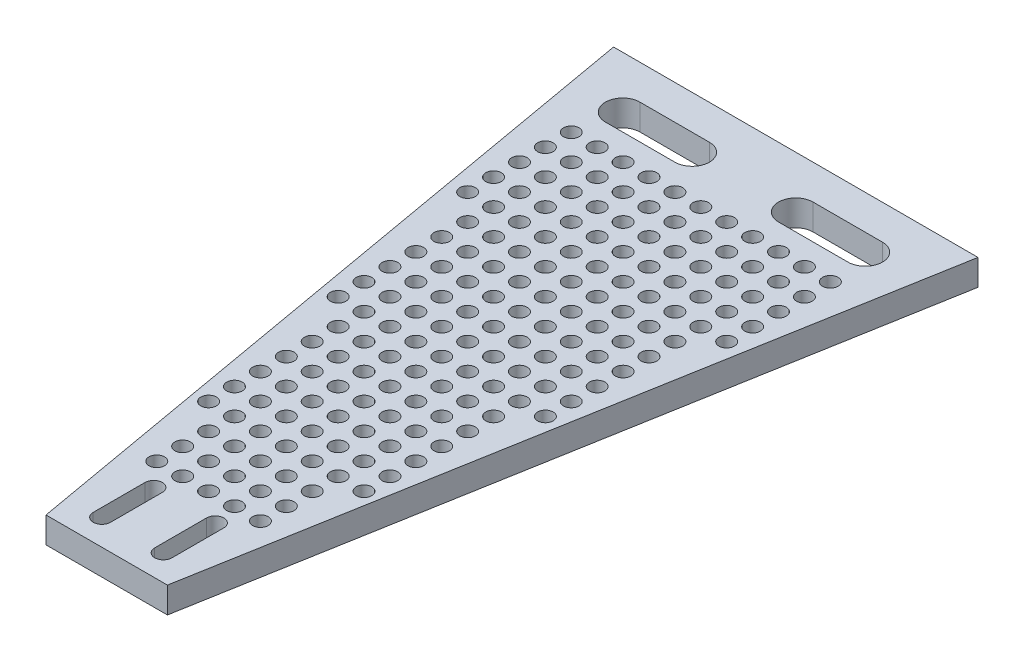
from build123d import *

# Parameters (mm, degrees)
BOSS_EXTRUDE1_DEPTH = 15
CUT_EXTRUDE1_DEPTH  = 15
SKETCH3_R           = 4.5
CUT_EXTRUDE19_DEPTH = 15


with BuildPart() as part:
    # Sketch1 → Boss-Extrude1 (new body)
    with BuildSketch(Plane(origin=(0, 0, 0), x_dir=(1, 0, 0), z_dir=(0, 1, 0))):
        Polygon((35.15527556, -199.492798703), (105.507201297, 199.492798703), (-105.507201297, 199.492798703), (-35.15527556, -199.492798703), align=None)
    extrude(amount=BOSS_EXTRUDE1_DEPTH)

    # Sketch2 → Cut-Extrude1 (cut)
    with BuildSketch(Plane(origin=(0, 0, 0), x_dir=(-1, 0, 0), z_dir=(0, -1, 0))):
        with BuildLine():
            Line((70.217391876, 159.492798703), (30, 159.492798703))
            ThreePointArc((30, 159.492798703), (20, 169.492798703), (30, 179.492798703))
            Line((30, 179.492798703), (70.217391876, 179.492798703))
            ThreePointArc((70.217391876, 179.492798703), (80.217391876, 169.492798703), (70.217391876, 159.492798703))
        make_face()
        with BuildLine():
            Line((-30, 159.492798703), (-70.217391876, 159.492798703))
            ThreePointArc((-70.217391876, 159.492798703), (-80.217391876, 169.492798703), (-70.217391876, 179.492798703))
            Line((-70.217391876, 179.492798703), (-30, 179.492798703))
            ThreePointArc((-30, 179.492798703), (-20, 169.492798703), (-30, 159.492798703))
        make_face()
        with BuildLine():
            Line((-12.800180271, -154.492798703), (-12.800180271, -184.492798703))
            ThreePointArc((-12.800180271, -184.492798703), (-17.800180271, -189.492798703), (-22.800180271, -184.492798703))
            Line((-22.800180271, -184.492798703), (-22.800180271, -154.492798703))
            ThreePointArc((-22.800180271, -154.492798703), (-17.800180271, -149.492798703), (-12.800180271, -154.492798703))
        make_face()
        with BuildLine():
            Line((22.800180271, -154.492798703), (22.800180271, -184.492798703))
            ThreePointArc((22.800180271, -184.492798703), (17.800180271, -189.492798703), (12.800180271, -184.492798703))
            Line((12.800180271, -184.492798703), (12.800180271, -154.492798703))
            ThreePointArc((12.800180271, -154.492798703), (17.800180271, -149.492798703), (22.800180271, -154.492798703))
        make_face()
    extrude(amount=-CUT_EXTRUDE1_DEPTH, mode=Mode.SUBTRACT)

    # Sketch3 → Cut-Extrude19 (cut)
    with BuildSketch(Plane(origin=(0, 0, 0), x_dir=(1, 0, 0), z_dir=(0, 1, 0))):
        with Locations(Location((0, 144.492798703, 0), (0, 0, 270))):
            Circle(SKETCH3_R)
        with Locations(Location((15, 144.492798703, 0), (0, 0, 270))):
            Circle(SKETCH3_R)
        with Locations(Location((30, 144.492798703, 0), (0, 0, 270))):
            Circle(SKETCH3_R)
        with Locations(Location((45, 144.492798703, 0), (0, 0, 270))):
            Circle(SKETCH3_R)
        with Locations(Location((60, 144.492798703, 0), (0, 0, 270))):
            Circle(SKETCH3_R)
        with Locations(Location((75, 144.492798703, 0), (0, 0, 270))):
            Circle(SKETCH3_R)
        with Locations(Location((15, 129.492798703, 0), (0, 0, 270))):
            Circle(SKETCH3_R)
        with Locations(Location((30, 129.492798703, 0), (0, 0, 270))):
            Circle(SKETCH3_R)
        with Locations(Location((45, 129.492798703, 0), (0, 0, 270))):
            Circle(SKETCH3_R)
        with Locations(Location((60, 129.492798703, 0), (0, 0, 270))):
            Circle(SKETCH3_R)
        with Locations(Location((75, 129.492798703, 0), (0, 0, 270))):
            Circle(SKETCH3_R)
        with Locations(Location((15, 114.492798703, 0), (0, 0, 270))):
            Circle(SKETCH3_R)
        with Locations(Location((30, 114.492798703, 0), (0, 0, 270))):
            Circle(SKETCH3_R)
        with Locations(Location((45, 114.492798703, 0), (0, 0, 270))):
            Circle(SKETCH3_R)
        with Locations(Location((60, 114.492798703, 0), (0, 0, 270))):
            Circle(SKETCH3_R)
        with Locations(Location((75, 114.492798703, 0), (0, 0, 270))):
            Circle(SKETCH3_R)
        with Locations(Location((15, 99.492798703, 0), (0, 0, 270))):
            Circle(SKETCH3_R)
        with Locations(Location((30, 99.492798703, 0), (0, 0, 270))):
            Circle(SKETCH3_R)
        with Locations(Location((45, 99.492798703, 0), (0, 0, 270))):
            Circle(SKETCH3_R)
        with Locations(Location((60, 99.492798703, 0), (0, 0, 270))):
            Circle(SKETCH3_R)
        with Locations(Location((75, 99.492798703, 0), (0, 0, 270))):
            Circle(SKETCH3_R)
        with Locations(Location((15, 84.492798703, 0), (0, 0, 270))):
            Circle(SKETCH3_R)
        with Locations(Location((30, 84.492798703, 0), (0, 0, 270))):
            Circle(SKETCH3_R)
        with Locations(Location((45, 84.492798703, 0), (0, 0, 270))):
            Circle(SKETCH3_R)
        with Locations(Location((60, 84.492798703, 0), (0, 0, 270))):
            Circle(SKETCH3_R)
        with Locations(Location((75, 84.492798703, 0), (0, 0, 270))):
            Circle(SKETCH3_R)
        with Locations(Location((15, 69.492798703, 0), (0, 0, 270))):
            Circle(SKETCH3_R)
        with Locations(Location((30, 69.492798703, 0), (0, 0, 270))):
            Circle(SKETCH3_R)
        with Locations(Location((45, 69.492798703, 0), (0, 0, 270))):
            Circle(SKETCH3_R)
        with Locations(Location((60, 69.492798703, 0), (0, 0, 270))):
            Circle(SKETCH3_R)
        with Locations(Location((15, 54.492798703, 0), (0, 0, 270))):
            Circle(SKETCH3_R)
        with Locations(Location((30, 54.492798703, 0), (0, 0, 270))):
            Circle(SKETCH3_R)
        with Locations(Location((45, 54.492798703, 0), (0, 0, 270))):
            Circle(SKETCH3_R)
        with Locations(Location((60, 54.492798703, 0), (0, 0, 270))):
            Circle(SKETCH3_R)
        with Locations(Location((15, 39.492798703, 0), (0, 0, 270))):
            Circle(SKETCH3_R)
        with Locations(Location((30, 39.492798703, 0), (0, 0, 270))):
            Circle(SKETCH3_R)
        with Locations(Location((45, 39.492798703, 0), (0, 0, 270))):
            Circle(SKETCH3_R)
        with Locations(Location((60, 39.492798703, 0), (0, 0, 270))):
            Circle(SKETCH3_R)
        with Locations(Location((15, 24.492798703, 0), (0, 0, 270))):
            Circle(SKETCH3_R)
        with Locations(Location((30, 24.492798703, 0), (0, 0, 270))):
            Circle(SKETCH3_R)
        with Locations(Location((45, 24.492798703, 0), (0, 0, 270))):
            Circle(SKETCH3_R)
        with Locations(Location((60, 24.492798703, 0), (0, 0, 270))):
            Circle(SKETCH3_R)
        with Locations(Location((15, 9.492798703, 0), (0, 0, 270))):
            Circle(SKETCH3_R)
        with Locations(Location((30, 9.492798703, 0), (0, 0, 270))):
            Circle(SKETCH3_R)
        with Locations(Location((45, 9.492798703, 0), (0, 0, 270))):
            Circle(SKETCH3_R)
        with Locations(Location((60, 9.492798703, 0), (0, 0, 270))):
            Circle(SKETCH3_R)
        with Locations(Location((15, -5.507201297, 0), (0, 0, 270))):
            Circle(SKETCH3_R)
        with Locations(Location((30, -5.507201297, 0), (0, 0, 270))):
            Circle(SKETCH3_R)
        with Locations(Location((45, -5.507201297, 0), (0, 0, 270))):
            Circle(SKETCH3_R)
        with Locations(Location((60, -5.507201297, 0), (0, 0, 270))):
            Circle(SKETCH3_R)
        with Locations(Location((15, -20.507201297, 0), (0, 0, 270))):
            Circle(SKETCH3_R)
        with Locations(Location((30, -20.507201297, 0), (0, 0, 270))):
            Circle(SKETCH3_R)
        with Locations(Location((45, -20.507201297, 0), (0, 0, 270))):
            Circle(SKETCH3_R)
        with Locations(Location((15, -35.507201297, 0), (0, 0, 270))):
            Circle(SKETCH3_R)
        with Locations(Location((30, -35.507201297, 0), (0, 0, 270))):
            Circle(SKETCH3_R)
        with Locations(Location((45, -35.507201297, 0), (0, 0, 270))):
            Circle(SKETCH3_R)
        with Locations(Location((15, -50.507201297, 0), (0, 0, 270))):
            Circle(SKETCH3_R)
        with Locations(Location((30, -50.507201297, 0), (0, 0, 270))):
            Circle(SKETCH3_R)
        with Locations(Location((45, -50.507201297, 0), (0, 0, 270))):
            Circle(SKETCH3_R)
        with Locations(Location((15, -65.507201297, 0), (0, 0, 270))):
            Circle(SKETCH3_R)
        with Locations(Location((30, -65.507201297, 0), (0, 0, 270))):
            Circle(SKETCH3_R)
        with Locations(Location((45, -65.507201297, 0), (0, 0, 270))):
            Circle(SKETCH3_R)
        with Locations(Location((15, -80.507201297, 0), (0, 0, 270))):
            Circle(SKETCH3_R)
        with Locations(Location((30, -80.507201297, 0), (0, 0, 270))):
            Circle(SKETCH3_R)
        with Locations(Location((45, -80.507201297, 0), (0, 0, 270))):
            Circle(SKETCH3_R)
        with Locations(Location((15, -95.507201297, 0), (0, 0, 270))):
            Circle(SKETCH3_R)
        with Locations(Location((30, -95.507201297, 0), (0, 0, 270))):
            Circle(SKETCH3_R)
        with Locations(Location((45, -95.507201297, 0), (0, 0, 270))):
            Circle(SKETCH3_R)
        with Locations(Location((15, -110.507201297, 0), (0, 0, 270))):
            Circle(SKETCH3_R)
        with Locations(Location((30, -110.507201297, 0), (0, 0, 270))):
            Circle(SKETCH3_R)
        with Locations(Location((15, -125.507201297, 0), (0, 0, 270))):
            Circle(SKETCH3_R)
        with Locations(Location((30, -125.507201297, 0), (0, 0, 270))):
            Circle(SKETCH3_R)
        with Locations(Location((15, -140.507201297, 0), (0, 0, 270))):
            Circle(SKETCH3_R)
        with Locations(Location((30, -140.507201297, 0), (0, 0, 270))):
            Circle(SKETCH3_R)
        with Locations(Location((0, 129.492798703, 0), (0, 0, 270))):
            Circle(SKETCH3_R)
        with Locations(Location((0, 114.492798703, 0), (0, 0, 270))):
            Circle(SKETCH3_R)
        with Locations(Location((0, 99.492798703, 0), (0, 0, 270))):
            Circle(SKETCH3_R)
        with Locations(Location((0, 84.492798703, 0), (0, 0, 270))):
            Circle(SKETCH3_R)
        with Locations(Location((0, 69.492798703, 0), (0, 0, 270))):
            Circle(SKETCH3_R)
        with Locations(Location((0, 54.492798703, 0), (0, 0, 270))):
            Circle(SKETCH3_R)
        with Locations(Location((0, 39.492798703, 0), (0, 0, 270))):
            Circle(SKETCH3_R)
        with Locations(Location((0, 24.492798703, 0), (0, 0, 270))):
            Circle(SKETCH3_R)
        with Locations(Location((0, 9.492798703, 0), (0, 0, 270))):
            Circle(SKETCH3_R)
        with Locations(Location((0, -5.507201297, 0), (0, 0, 270))):
            Circle(SKETCH3_R)
        with Locations(Location((0, -20.507201297, 0), (0, 0, 270))):
            Circle(SKETCH3_R)
        with Locations(Location((0, -35.507201297, 0), (0, 0, 270))):
            Circle(SKETCH3_R)
        with Locations(Location((0, -50.507201297, 0), (0, 0, 270))):
            Circle(SKETCH3_R)
        with Locations(Location((0, -65.507201297, 0), (0, 0, 270))):
            Circle(SKETCH3_R)
        with Locations(Location((0, -80.507201297, 0), (0, 0, 270))):
            Circle(SKETCH3_R)
        with Locations(Location((0, -95.507201297, 0), (0, 0, 270))):
            Circle(SKETCH3_R)
        with Locations(Location((0, -110.507201297, 0), (0, 0, 270))):
            Circle(SKETCH3_R)
        with Locations(Location((0, -125.507201297, 0), (0, 0, 270))):
            Circle(SKETCH3_R)
        with Locations(Location((0, -140.507201297, 0), (0, 0, 270))):
            Circle(SKETCH3_R)
        with Locations(Location((-15, 144.492798703, 0), (0, 0, 270))):
            Circle(SKETCH3_R)
        with Locations(Location((-30, 144.492798703, 0), (0, 0, 270))):
            Circle(SKETCH3_R)
        with Locations(Location((-45, 144.492798703, 0), (0, 0, 270))):
            Circle(SKETCH3_R)
        with Locations(Location((-60, 144.492798703, 0), (0, 0, 270))):
            Circle(SKETCH3_R)
        with Locations(Location((-75, 144.492798703, 0), (0, 0, 270))):
            Circle(SKETCH3_R)
        with Locations(Location((-30, 129.492798703, 0), (0, 0, 270))):
            Circle(SKETCH3_R)
        with Locations(Location((-45, 129.492798703, 0), (0, 0, 270))):
            Circle(SKETCH3_R)
        with Locations(Location((-60, 129.492798703, 0), (0, 0, 270))):
            Circle(SKETCH3_R)
        with Locations(Location((-75, 129.492798703, 0), (0, 0, 270))):
            Circle(SKETCH3_R)
        with Locations(Location((-30, 114.492798703, 0), (0, 0, 270))):
            Circle(SKETCH3_R)
        with Locations(Location((-45, 114.492798703, 0), (0, 0, 270))):
            Circle(SKETCH3_R)
        with Locations(Location((-60, 114.492798703, 0), (0, 0, 270))):
            Circle(SKETCH3_R)
        with Locations(Location((-75, 114.492798703, 0), (0, 0, 270))):
            Circle(SKETCH3_R)
        with Locations(Location((-30, 99.492798703, 0), (0, 0, 270))):
            Circle(SKETCH3_R)
        with Locations(Location((-45, 99.492798703, 0), (0, 0, 270))):
            Circle(SKETCH3_R)
        with Locations(Location((-60, 99.492798703, 0), (0, 0, 270))):
            Circle(SKETCH3_R)
        with Locations(Location((-75, 99.492798703, 0), (0, 0, 270))):
            Circle(SKETCH3_R)
        with Locations(Location((-30, 84.492798703, 0), (0, 0, 270))):
            Circle(SKETCH3_R)
        with Locations(Location((-45, 84.492798703, 0), (0, 0, 270))):
            Circle(SKETCH3_R)
        with Locations(Location((-60, 84.492798703, 0), (0, 0, 270))):
            Circle(SKETCH3_R)
        with Locations(Location((-75, 84.492798703, 0), (0, 0, 270))):
            Circle(SKETCH3_R)
        with Locations(Location((-30, 69.492798703, 0), (0, 0, 270))):
            Circle(SKETCH3_R)
        with Locations(Location((-45, 69.492798703, 0), (0, 0, 270))):
            Circle(SKETCH3_R)
        with Locations(Location((-60, 69.492798703, 0), (0, 0, 270))):
            Circle(SKETCH3_R)
        with Locations(Location((-30, 54.492798703, 0), (0, 0, 270))):
            Circle(SKETCH3_R)
        with Locations(Location((-45, 54.492798703, 0), (0, 0, 270))):
            Circle(SKETCH3_R)
        with Locations(Location((-60, 54.492798703, 0), (0, 0, 270))):
            Circle(SKETCH3_R)
        with Locations(Location((-30, 39.492798703, 0), (0, 0, 270))):
            Circle(SKETCH3_R)
        with Locations(Location((-45, 39.492798703, 0), (0, 0, 270))):
            Circle(SKETCH3_R)
        with Locations(Location((-60, 39.492798703, 0), (0, 0, 270))):
            Circle(SKETCH3_R)
        with Locations(Location((-30, 24.492798703, 0), (0, 0, 270))):
            Circle(SKETCH3_R)
        with Locations(Location((-45, 24.492798703, 0), (0, 0, 270))):
            Circle(SKETCH3_R)
        with Locations(Location((-60, 24.492798703, 0), (0, 0, 270))):
            Circle(SKETCH3_R)
        with Locations(Location((-30, 9.492798703, 0), (0, 0, 270))):
            Circle(SKETCH3_R)
        with Locations(Location((-45, 9.492798703, 0), (0, 0, 270))):
            Circle(SKETCH3_R)
        with Locations(Location((-60, 9.492798703, 0), (0, 0, 270))):
            Circle(SKETCH3_R)
        with Locations(Location((-30, -5.507201297, 0), (0, 0, 270))):
            Circle(SKETCH3_R)
        with Locations(Location((-45, -5.507201297, 0), (0, 0, 270))):
            Circle(SKETCH3_R)
        with Locations(Location((-60, -5.507201297, 0), (0, 0, 270))):
            Circle(SKETCH3_R)
        with Locations(Location((-30, -20.507201297, 0), (0, 0, 270))):
            Circle(SKETCH3_R)
        with Locations(Location((-45, -20.507201297, 0), (0, 0, 270))):
            Circle(SKETCH3_R)
        with Locations(Location((-30, -35.507201297, 0), (0, 0, 270))):
            Circle(SKETCH3_R)
        with Locations(Location((-45, -35.507201297, 0), (0, 0, 270))):
            Circle(SKETCH3_R)
        with Locations(Location((-30, -50.507201297, 0), (0, 0, 270))):
            Circle(SKETCH3_R)
        with Locations(Location((-45, -50.507201297, 0), (0, 0, 270))):
            Circle(SKETCH3_R)
        with Locations(Location((-30, -65.507201297, 0), (0, 0, 270))):
            Circle(SKETCH3_R)
        with Locations(Location((-45, -65.507201297, 0), (0, 0, 270))):
            Circle(SKETCH3_R)
        with Locations(Location((-30, -80.507201297, 0), (0, 0, 270))):
            Circle(SKETCH3_R)
        with Locations(Location((-45, -80.507201297, 0), (0, 0, 270))):
            Circle(SKETCH3_R)
        with Locations(Location((-30, -95.507201297, 0), (0, 0, 270))):
            Circle(SKETCH3_R)
        with Locations(Location((-45, -95.507201297, 0), (0, 0, 270))):
            Circle(SKETCH3_R)
        with Locations(Location((-30, -110.507201297, 0), (0, 0, 270))):
            Circle(SKETCH3_R)
        with Locations(Location((-30, -125.507201297, 0), (0, 0, 270))):
            Circle(SKETCH3_R)
        with Locations(Location((-30, -140.507201297, 0), (0, 0, 270))):
            Circle(SKETCH3_R)
        with Locations(Location((-15, 129.492798703, 0), (0, 0, 270))):
            Circle(SKETCH3_R)
        with Locations(Location((-15, 114.492798703, 0), (0, 0, 270))):
            Circle(SKETCH3_R)
        with Locations(Location((-15, 99.492798703, 0), (0, 0, 270))):
            Circle(SKETCH3_R)
        with Locations(Location((-15, 84.492798703, 0), (0, 0, 270))):
            Circle(SKETCH3_R)
        with Locations(Location((-15, 69.492798703, 0), (0, 0, 270))):
            Circle(SKETCH3_R)
        with Locations(Location((-15, 54.492798703, 0), (0, 0, 270))):
            Circle(SKETCH3_R)
        with Locations(Location((-15, 39.492798703, 0), (0, 0, 270))):
            Circle(SKETCH3_R)
        with Locations(Location((-15, 24.492798703, 0), (0, 0, 270))):
            Circle(SKETCH3_R)
        with Locations(Location((-15, 9.492798703, 0), (0, 0, 270))):
            Circle(SKETCH3_R)
        with Locations(Location((-15, -5.507201297, 0), (0, 0, 270))):
            Circle(SKETCH3_R)
        with Locations(Location((-15, -20.507201297, 0), (0, 0, 270))):
            Circle(SKETCH3_R)
        with Locations(Location((-15, -35.507201297, 0), (0, 0, 270))):
            Circle(SKETCH3_R)
        with Locations(Location((-15, -50.507201297, 0), (0, 0, 270))):
            Circle(SKETCH3_R)
        with Locations(Location((-15, -65.507201297, 0), (0, 0, 270))):
            Circle(SKETCH3_R)
        with Locations(Location((-15, -80.507201297, 0), (0, 0, 270))):
            Circle(SKETCH3_R)
        with Locations(Location((-15, -95.507201297, 0), (0, 0, 270))):
            Circle(SKETCH3_R)
        with Locations(Location((-15, -110.507201297, 0), (0, 0, 270))):
            Circle(SKETCH3_R)
        with Locations(Location((-15, -125.507201297, 0), (0, 0, 270))):
            Circle(SKETCH3_R)
        with Locations(Location((-15, -140.507201297, 0), (0, 0, 270))):
            Circle(SKETCH3_R)
    extrude(amount=CUT_EXTRUDE19_DEPTH, mode=Mode.SUBTRACT)


solid = part.part
